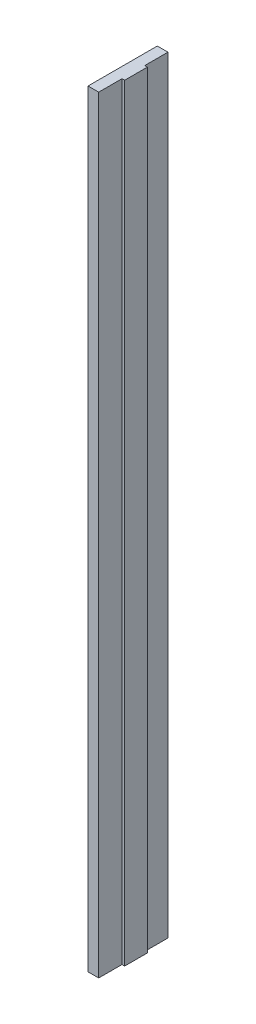
from build123d import *

# Parameters (mm, degrees)
ESQUISSE1_W             = 82.55
ESQUISSE1_H             = 914.4
BOSS_EXTRU_1_DEPTH      = 15.875
ENL_V_MAT_EXTRU_1_DEPTH = 916.468733082


with BuildPart() as part:
    # Esquisse1 → Boss.-Extru.1 (new body)
    with BuildSketch(Plane(origin=(0, 0, 0), x_dir=(0, 0, -1), z_dir=(1, 0, 0))):
        Rectangle(ESQUISSE1_W, ESQUISSE1_H)
    extrude(amount=BOSS_EXTRU_1_DEPTH)

    # Esquisse3 → Enlèv. mat.-Extru.1 (cut, through all)
    with BuildSketch(Plane(origin=(0, 457.2, 0), x_dir=(1, 0, 0), z_dir=(0, 1, 0))):
        Polygon((12.7, 41.275), (38.1, 41.275), (38.1, -41.275), (12.7, -41.275), (12.7, -13.5), (19.05, -13.5), (19.05, 13.5), (12.7, 13.5), align=None)
    extrude(amount=-ENL_V_MAT_EXTRU_1_DEPTH, mode=Mode.SUBTRACT)


solid = part.part
